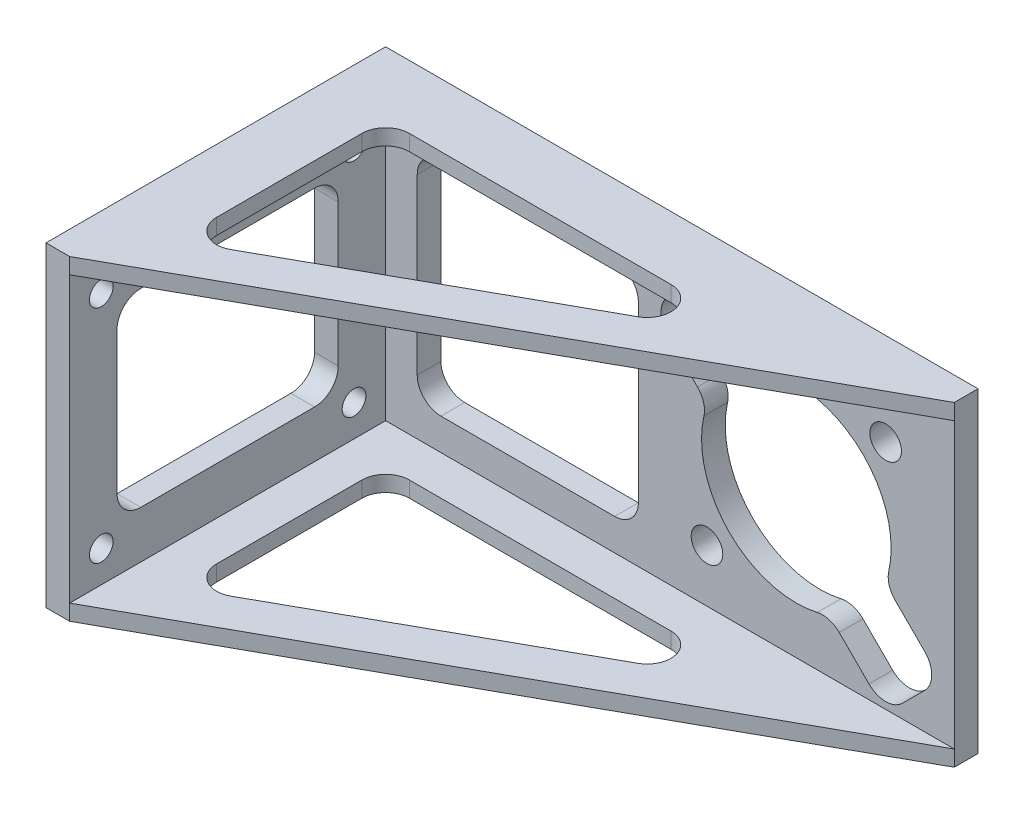
from build123d import *

# Parameters (mm, degrees)
SKETCH_1_W          = 40
SKETCH_1_H          = 40
SKETCH_1_R          = 2
SKETCH_1_R_2        = 12
EXTRUDE_1_DEPTH     = 3
SKETCH_2_W          = 35
SKETCH_2_H          = 40
EXTRUDE_2_DEPTH     = 3
SKETCH_3_W          = 3
SKETCH_3_H          = 40
EXTRUDE_3_DEPTH     = 40
EXTRUDE_4_DEPTH     = 2
EXTRUDE_5_DEPTH     = 2
SKETCH_6_R          = 1.5
SKETCH_6_W          = 28
SKETCH_6_H          = 24
CUT_EXTRUDE_1_DEPTH = 12
FILLET_1_R          = 3
SKETCH_7_W          = 28
SKETCH_7_H          = 28
CUT_EXTRUDE_2_DEPTH = 12
FILLET_2_R          = 3
CUT_EXTRUDE_3_DEPTH = 49
FILLET_3_R          = 3
FILLET_4_R          = 3
CUT_EXTRUDE_4_DEPTH = 10
FILLET_5_R          = 3


with BuildPart() as part:
    # 草图1 → 凸台-拉伸1 (new body)
    with BuildSketch(Plane.XY):
        Rectangle(SKETCH_1_W, SKETCH_1_H)
        with Locations((11.313708499, 11.313708499)):
            Circle(SKETCH_1_R, mode=Mode.SUBTRACT)
        with Locations((11.313708499, -11.313708499)):
            Circle(SKETCH_1_R, mode=Mode.SUBTRACT)
        with Locations((-11.313708499, -11.313708499)):
            Circle(SKETCH_1_R, mode=Mode.SUBTRACT)
        with Locations((-11.313708499, 11.313708499)):
            Circle(SKETCH_1_R, mode=Mode.SUBTRACT)
        Circle(SKETCH_1_R_2, mode=Mode.SUBTRACT)
    extrude(amount=EXTRUDE_1_DEPTH)

    # 草图2 → 凸台-拉伸2 (add)
    with BuildSketch(Plane.XY.offset(3)):
        with Locations((-37.5, 0)):
            Rectangle(SKETCH_2_W, SKETCH_2_H)
    extrude(amount=-EXTRUDE_2_DEPTH)

    # 草图3 → 凸台-拉伸3 (add)
    with BuildSketch(Plane.XY.offset(3)):
        with Locations((-53.5, 0)):
            Rectangle(SKETCH_3_W, SKETCH_3_H)
    extrude(amount=EXTRUDE_3_DEPTH)

    # 草图4 → 凸台-拉伸4 (add)
    with BuildSketch(Plane(origin=(0, 20, 0), x_dir=(1, 0, 0), z_dir=(0, 1, 0))):
        Polygon((-52, -43), (20, -3), (-52, -3), align=None)
    extrude(amount=-EXTRUDE_4_DEPTH)

    # 草图5 → 凸台-拉伸5 (add)
    with BuildSketch(Plane.XZ.offset(20)):
        Polygon((-52, 43), (-52, 3), (20, 3), align=None)
    extrude(amount=-EXTRUDE_5_DEPTH)

    # 草图6 → 切除-拉伸1 (cut)
    with BuildSketch(Plane(origin=(-52, 0, 0), x_dir=(0, 0, -1), z_dir=(1, 0, 0))):
        with Locations((-39, 14)):
            Circle(SKETCH_6_R)
        with Locations((-7, 14)):
            Circle(SKETCH_6_R)
        with Locations((-7, -14)):
            Circle(SKETCH_6_R)
        with Locations((-39, -14)):
            Circle(SKETCH_6_R)
        with Locations((-23, 0)):
            Rectangle(SKETCH_6_W, SKETCH_6_H)
    extrude(amount=-CUT_EXTRUDE_1_DEPTH, mode=Mode.SUBTRACT)

    # 圆角1
    fillet_1_edges = [part.edges().sort_by_distance(p)[0] for p in [
        (-53.5, -12, 37),
        (-53.5, 12, 37),
        (-53.5, 12, 9),
        (-53.5, -12, 9),
    ]]
    fillet(fillet_1_edges, radius=FILLET_1_R)

    # 草图7 → 切除-拉伸2 (cut)
    with BuildSketch(Plane.XY.offset(3)):
        with Locations((-34, 0)):
            Rectangle(SKETCH_7_W, SKETCH_7_H)
    extrude(amount=-CUT_EXTRUDE_2_DEPTH, mode=Mode.SUBTRACT)

    # 圆角2
    fillet_2_edges = [part.edges().sort_by_distance(p)[0] for p in [
        (-20, 14, 1.5),
        (-20, -14, 1.5),
        (-48, -14, 1.5),
        (-48, 14, 1.5),
    ]]
    fillet(fillet_2_edges, radius=FILLET_2_R)

    # 草图8 → 切除-拉伸3 (cut)
    with BuildSketch(Plane(origin=(0, 20, 0), x_dir=(1, 0, 0), z_dir=(0, 1, 0))):
        Polygon((-47, -34.502427699), (-47, -8), (0.704369859, -8), align=None)
    extrude(amount=-CUT_EXTRUDE_3_DEPTH, mode=Mode.SUBTRACT)

    # 圆角3
    fillet_3_edges = [part.edges().sort_by_distance(p)[0] for p in [
        (0.704369859, 19, 8),
        (-47, 19, 34.502427699),
        (-47, 19, 8),
    ]]
    fillet(fillet_3_edges, radius=FILLET_3_R)

    # 圆角4
    fillet_4_edges = [part.edges().sort_by_distance(p)[0] for p in [
        (0.704369859, -19, 8),
        (-47, -19, 34.502427699),
        (-47, -19, 8),
    ]]
    fillet(fillet_4_edges, radius=FILLET_4_R)

    # 草图9 → 切除-拉伸4 (cut)
    with BuildSketch(Plane.XY.offset(3)):
        with BuildLine():
            Line((-4.949747468, 12.02081528), (-1.998451999, 9.069519811))
            Line((-1.998451999, 9.069519811), (12.02081528, -4.949747468))
            Line((12.02081528, -4.949747468), (16.263455967, -9.192388155))
            ThreePointArc((16.263455967, -9.192388155), (17.142135624, -11.313708499), (16.263455967, -13.435028843))
            Line((16.263455967, -13.435028843), (13.435028843, -16.263455967))
            ThreePointArc((13.435028843, -16.263455967), (11.313708499, -17.142135624), (9.192388155, -16.263455967))
            Line((9.192388155, -16.263455967), (4.949747468, -12.02081528))
            Line((4.949747468, -12.02081528), (-9.069519811, 1.998451999))
            Line((-9.069519811, 1.998451999), (-12.02081528, 4.949747468))
            Line((-12.02081528, 4.949747468), (-16.263455967, 9.192388155))
            ThreePointArc((-16.263455967, 9.192388155), (-17.142135624, 11.313708499), (-16.263455967, 13.435028843))
            Line((-16.263455967, 13.435028843), (-13.435028843, 16.263455967))
            ThreePointArc((-13.435028843, 16.263455967), (-11.313708499, 17.142135624), (-9.192388155, 16.263455967))
            Line((-9.192388155, 16.263455967), (-4.949747468, 12.02081528))
        make_face()
    extrude(amount=-CUT_EXTRUDE_4_DEPTH, mode=Mode.SUBTRACT)

    # 圆角5
    fillet_5_edges = [part.edges().sort_by_distance(p)[0] for p in [
        (4.178090404, -11.249158216, 1.5),
        (-11.249158216, 4.178090404, 1.5),
        (-4.178090404, 11.249158216, 1.5),
        (11.249158216, -4.178090404, 1.5),
    ]]
    fillet(fillet_5_edges, radius=FILLET_5_R)


solid = part.part
